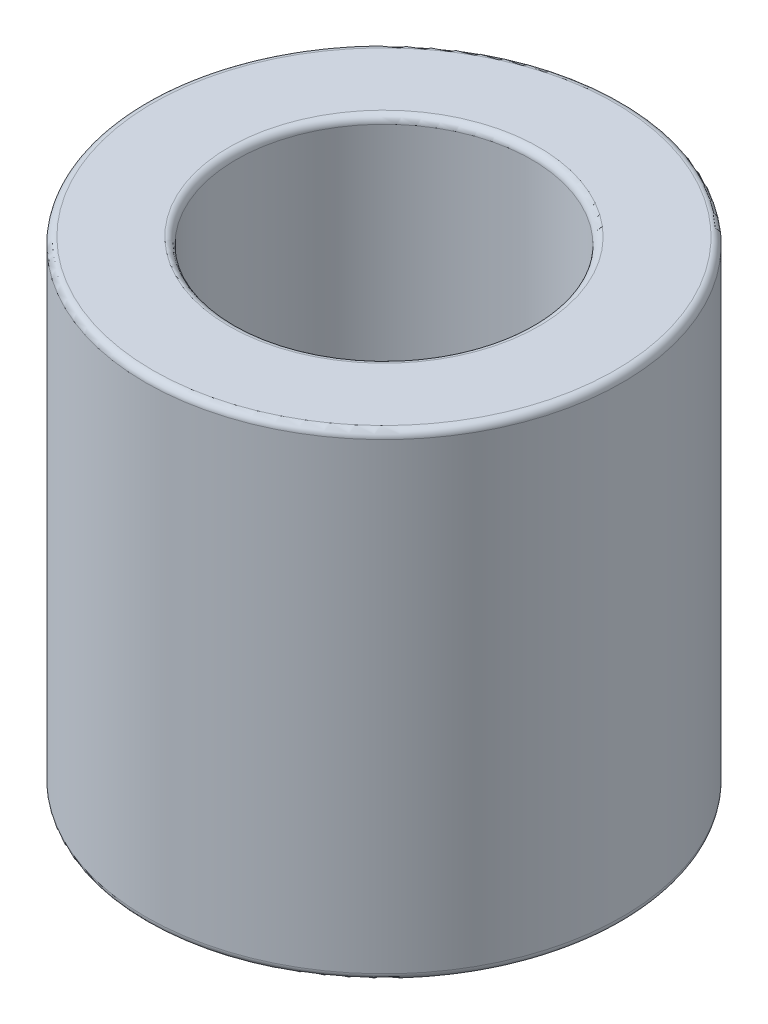
from build123d import *

# Parameters (mm, degrees)
SKETCH1_R           = 5
SKETCH1_R_2         = 3.1
BOSS_EXTRUDE1_DEPTH = 10
FILLET1_R           = 0.15


with BuildPart() as part:
    # Sketch1 → Boss-Extrude1 (new body)
    with BuildSketch(Plane(origin=(0, 0, 0), x_dir=(1, 0, 0), z_dir=(0, 1, 0))):
        with Locations(Location((0, 0, 0), (0, 0, 270))):
            Circle(SKETCH1_R)
        with Locations(Location((0, 0, 0), (0, 0, 270))):
            Circle(SKETCH1_R_2, mode=Mode.SUBTRACT)
    extrude(amount=BOSS_EXTRUDE1_DEPTH)

    # Fillet1
    fillet1_edges = [part.edges().sort_by_distance(p)[0] for p in [
        (0, 0, -5),
        (0, 10, -5),
        (0, 0, -3.1),
        (0, 10, -3.1),
    ]]
    fillet(fillet1_edges, radius=FILLET1_R)


solid = part.part
